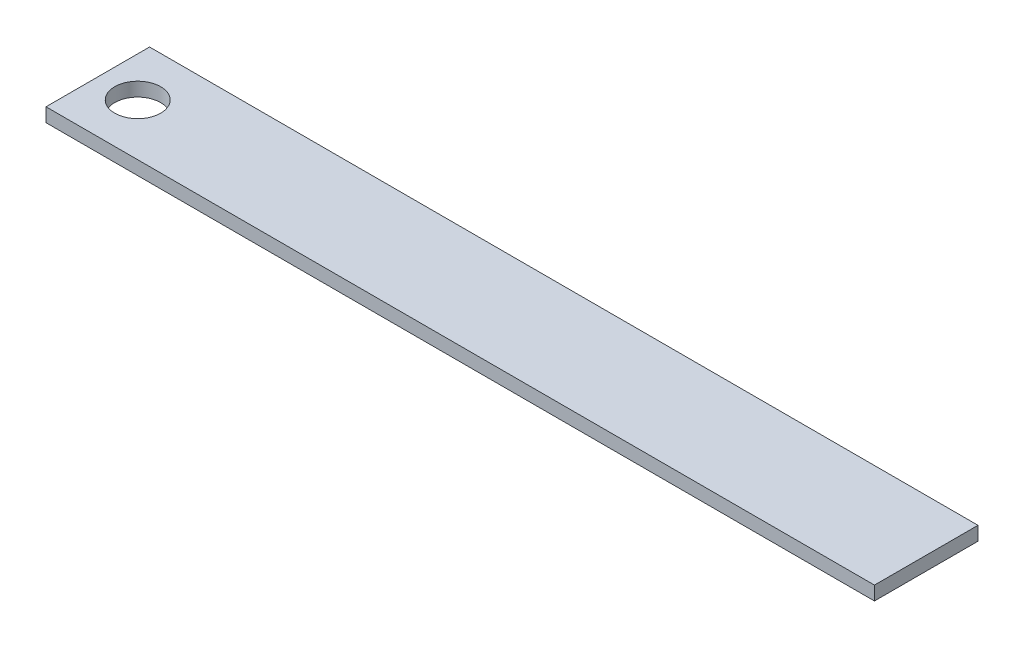
from build123d import *

# Parameters (mm, degrees)
SKETCH1_W           = 120
SKETCH1_H           = 15
SKETCH1_R           = 3.327558187
BOSS_EXTRUDE1_DEPTH = 2


with BuildPart() as part:
    # Sketch1 → Boss-Extrude1 (new body)
    with BuildSketch(Plane(origin=(0, 0, 0), x_dir=(1, 0, 0), z_dir=(0, 1, 0))):
        Rectangle(SKETCH1_W, SKETCH1_H)
        with Locations(Location((-54.217476842, 0, 0), (0, 0, 270))):
            Circle(SKETCH1_R, mode=Mode.SUBTRACT)
    extrude(amount=BOSS_EXTRUDE1_DEPTH)


solid = part.part
